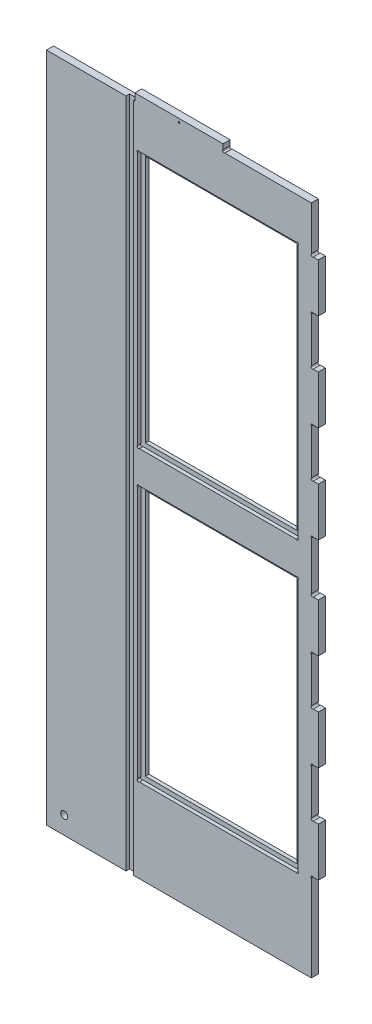
from build123d import *

# Parameters (mm, degrees)
ESQUISSE1_R             = 1
ESQUISSE1_W             = 172
ESQUISSE1_H             = 281.553390594
ESQUISSE1_H_2           = 280.534461641
BOSS_EXTRU_1_DEPTH      = 8
ENL_V_MAT_EXTRU_1_DEPTH = 4
ESQUISSE3_W             = 8.5
ESQUISSE3_H             = 760.715269233
ENL_V_MAT_EXTRU_2_DEPTH = 4
ESQUISSE4_R             = 4
ENL_V_MAT_EXTRU_3_DEPTH = 6


with BuildPart() as part:
    # Esquisse1 → Boss.-Extru.1 (new body)
    with BuildSketch(Plane.XY):
        with BuildLine():
            Line((-54.650090097, -45.819197646), (-54.650090097, 358.028972494))
            Line((-54.650090097, 358.028972494), (-54.650090097, 714.896071587))
            Line((-54.650090097, 714.896071587), (43.228589559, 714.896071587))
            ThreePointArc((43.228589559, 714.896071587), (45.349909903, 714.896071587), (45.349909903, 717.01739193))
            Line((45.349909903, 717.01739193), (45.349909903, 722.896071587))
            Line((45.349909903, 722.896071587), (145.349909903, 722.896071587))
            Line((145.349909903, 722.896071587), (145.349909903, 717.01739193))
            ThreePointArc((145.349909903, 717.01739193), (145.349909903, 714.896071587), (147.471230246, 714.896071587))
            Line((147.471230246, 714.896071587), (245.349909903, 714.896071587))
            Line((245.349909903, 714.896071587), (245.349909903, 665.01739193))
            ThreePointArc((245.349909903, 665.01739193), (245.349909903, 662.896071587), (247.471230246, 662.896071587))
            Line((247.471230246, 662.896071587), (253.349909903, 662.896071587))
            Line((253.349909903, 662.896071587), (253.349909903, 607.896071587))
            Line((253.349909903, 607.896071587), (247.471230246, 607.896071587))
            ThreePointArc((247.471230246, 607.896071587), (245.349909903, 607.896071587), (245.349909903, 605.774751243))
            Line((245.349909903, 605.774751243), (245.349909903, 555.01739193))
            ThreePointArc((245.349909903, 555.01739193), (245.349909903, 552.896071587), (247.471230246, 552.896071587))
            Line((247.471230246, 552.896071587), (253.349909903, 552.896071587))
            Line((253.349909903, 552.896071587), (253.349909903, 497.896071587))
            Line((253.349909903, 497.896071587), (247.471230246, 497.896071587))
            ThreePointArc((247.471230246, 497.896071587), (245.349909903, 497.896071587), (245.349909903, 495.774751243))
            Line((245.349909903, 495.774751243), (245.349909903, 445.01739193))
            ThreePointArc((245.349909903, 445.01739193), (245.349909903, 442.896071587), (247.471230246, 442.896071587))
            Line((247.471230246, 442.896071587), (253.349909903, 442.896071587))
            Line((253.349909903, 442.896071587), (253.349909903, 387.896071587))
            Line((253.349909903, 387.896071587), (247.471230246, 387.896071587))
            ThreePointArc((247.471230246, 387.896071587), (245.349909903, 387.896071587), (245.349909903, 385.774751243))
            Line((245.349909903, 385.774751243), (245.349909903, 331.302122698))
            ThreePointArc((245.349909903, 331.302122698), (245.349909903, 329.180802354), (247.471230246, 329.180802354))
            Line((247.471230246, 329.180802354), (253.349909903, 329.180802354))
            Line((253.349909903, 329.180802354), (253.349909903, 274.180802354))
            Line((253.349909903, 274.180802354), (247.471230246, 274.180802354))
            ThreePointArc((247.471230246, 274.180802354), (245.349909903, 274.180802354), (245.349909903, 272.059482011))
            Line((245.349909903, 272.059482011), (245.349909903, 221.302122698))
            ThreePointArc((245.349909903, 221.302122698), (245.349909903, 219.180802354), (247.471230246, 219.180802354))
            Line((247.471230246, 219.180802354), (253.349909903, 219.180802354))
            Line((253.349909903, 219.180802354), (253.349909903, 164.180802354))
            Line((253.349909903, 164.180802354), (247.471230246, 164.180802354))
            ThreePointArc((247.471230246, 164.180802354), (245.349909903, 164.180802354), (245.349909903, 162.059482011))
            Line((245.349909903, 162.059482011), (245.349909903, 111.302122698))
            ThreePointArc((245.349909903, 111.302122698), (245.349909903, 109.180802354), (247.471230246, 109.180802354))
            Line((247.471230246, 109.180802354), (253.349909903, 109.180802354))
            Line((253.349909903, 109.180802354), (253.349909903, 54.180802354))
            Line((253.349909903, 54.180802354), (247.471230246, 54.180802354))
            ThreePointArc((247.471230246, 54.180802354), (245.349909903, 54.180802354), (245.349909903, 52.059482011))
            Line((245.349909903, 52.059482011), (245.349909903, -45.819197646))
            Line((245.349909903, -45.819197646), (-54.650090097, -45.819197646))
        make_face()
        with Locations((95.349909903, 718.896071587)):
            Circle(ESQUISSE1_R, mode=Mode.SUBTRACT)
        with Locations((139.349909903, 522.11937629)):
            Rectangle(ESQUISSE1_W, ESQUISSE1_H, mode=Mode.SUBTRACT)
        with Locations((139.349909903, 194.448033175)):
            Rectangle(ESQUISSE1_W, ESQUISSE1_H_2, mode=Mode.SUBTRACT)
    extrude(amount=BOSS_EXTRU_1_DEPTH)

    # Esquisse2 → Enlèv. mat.-Extru.1 (cut)
    with BuildSketch(Plane.XY.offset(8)):
        with BuildLine():
            Line((50.471230246, 339.715263995), (228.228589559, 339.715263995))
            ThreePointArc((228.228589559, 339.715263995), (230.349909903, 339.715263995), (230.349909903, 337.593943652))
            Line((230.349909903, 337.593943652), (230.349909903, 51.302122698))
            ThreePointArc((230.349909903, 51.302122698), (230.349909903, 49.180802354), (228.228589559, 49.180802354))
            Line((228.228589559, 49.180802354), (50.471230246, 49.180802354))
            ThreePointArc((50.471230246, 49.180802354), (48.349909903, 49.180802354), (48.349909903, 51.302122698))
            Line((48.349909903, 51.302122698), (48.349909903, 337.593943652))
            ThreePointArc((48.349909903, 337.593943652), (48.349909903, 339.715263995), (50.471230246, 339.715263995))
        make_face()
        with BuildLine():
            Line((50.471230246, 667.896071587), (228.228589559, 667.896071587))
            ThreePointArc((228.228589559, 667.896071587), (230.349909903, 667.896071587), (230.349909903, 665.774751243))
            Line((230.349909903, 665.774751243), (230.349909903, 378.464001337))
            ThreePointArc((230.349909903, 378.464001337), (230.349909903, 376.342680993), (228.228589559, 376.342680993))
            Line((228.228589559, 376.342680993), (50.471230246, 376.342680993))
            ThreePointArc((50.471230246, 376.342680993), (48.349909903, 376.342680993), (48.349909903, 378.464001337))
            Line((48.349909903, 378.464001337), (48.349909903, 665.774751243))
            ThreePointArc((48.349909903, 665.774751243), (48.349909903, 667.896071587), (50.471230246, 667.896071587))
        make_face()
    extrude(amount=-ENL_V_MAT_EXTRU_1_DEPTH, mode=Mode.SUBTRACT)

    # Esquisse3 → Enlèv. mat.-Extru.2 (cut)
    with BuildSketch(Plane.XY.offset(8)):
        with Locations((39.599909903, 334.538436971)):
            Rectangle(ESQUISSE3_W, ESQUISSE3_H)
    extrude(amount=-ENL_V_MAT_EXTRU_2_DEPTH, mode=Mode.SUBTRACT)

    # Esquisse4 → Enlèv. mat.-Extru.3 (cut)
    with BuildSketch(Plane.XY.offset(8)):
        with Locations((-34.650090097, -25.819197646)):
            Circle(ESQUISSE4_R)
    extrude(amount=-ENL_V_MAT_EXTRU_3_DEPTH, mode=Mode.SUBTRACT)


solid = part.part
